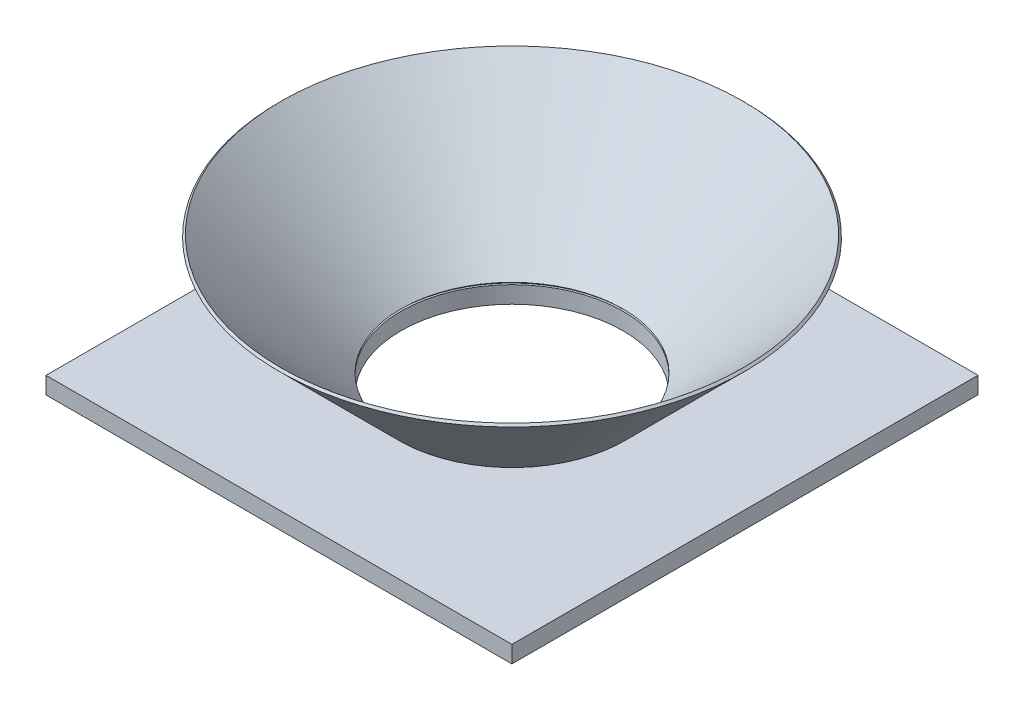
from build123d import *

# Parameters (mm, degrees)
SKETCH2_W           = 82.426406872
SKETCH2_H           = 82.457609212
SKETCH2_R           = 19.646446609
BOSS_EXTRUDE1_DEPTH = 3


with BuildPart() as part:
    # Sketch1 → Revolve1 (revolve)
    with BuildSketch(Plane.XY, mode=Mode.PRIVATE) as revolve1_sk:
        Polygon((-20, 0), (-41.213203436, 21.213203436), (-40.859650045, 21.566756826), (-19.646446609, 0.353553391), align=None)
    revolve(revolve1_sk.sketch.rotate(Axis((0, 0, 0), (0, 1, 0)), 270), axis=Axis((0, 0, 0), (0, 1, 0)))


with BuildPart() as body_2:
    # Sketch2 → Boss-Extrude1 (new body)
    with BuildSketch(Plane(origin=(0, 0, 0), x_dir=(1, 0, 0), z_dir=(0, 1, 0))):
        Rectangle(SKETCH2_W, SKETCH2_H)
        with Locations(Location((0, 0, 0), (0, 0, 270))):
            Circle(SKETCH2_R, mode=Mode.SUBTRACT)
    extrude(amount=-BOSS_EXTRUDE1_DEPTH)


solid = Compound([part.part, body_2.part])
